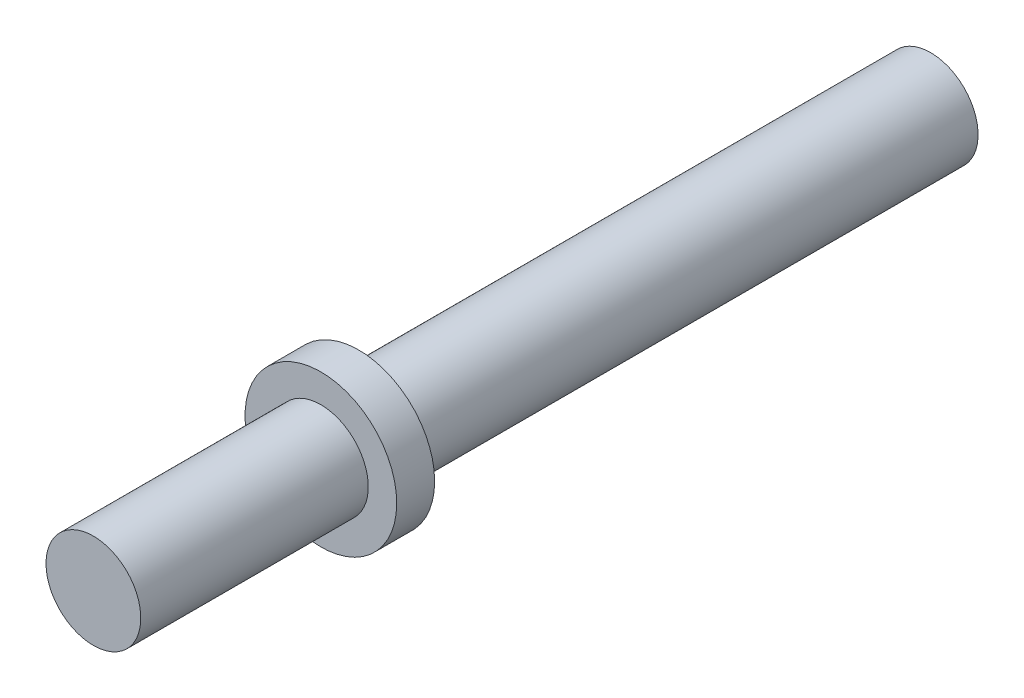
from build123d import *

# Parameters (mm, degrees)
PLUNGER_STEM_START     = 17.500063
SKETCH1_R              = 1.5
PLUNGER_STEM_DEPTH     = 26.499937
CAPTIVE_SHOULDER_START = 35.6
SKETCH2_R              = 2.4
CAPTIVE_SHOULDER_DEPTH = 1.2


with BuildPart() as part:
    # Sketch1 → Plunger_stem (new body)
    with BuildSketch(Plane.XY.offset(PLUNGER_STEM_START)):
        with Locations((-32.018684277, -41.745416557)):
            Circle(SKETCH1_R)
    extrude(amount=PLUNGER_STEM_DEPTH)

    # Sketch2 → Captive_shoulder (add)
    with BuildSketch(Plane.XY.offset(CAPTIVE_SHOULDER_START)):
        with Locations((-32.018684277, -41.745416557)):
            Circle(SKETCH2_R)
    extrude(amount=CAPTIVE_SHOULDER_DEPTH)


solid = part.part
